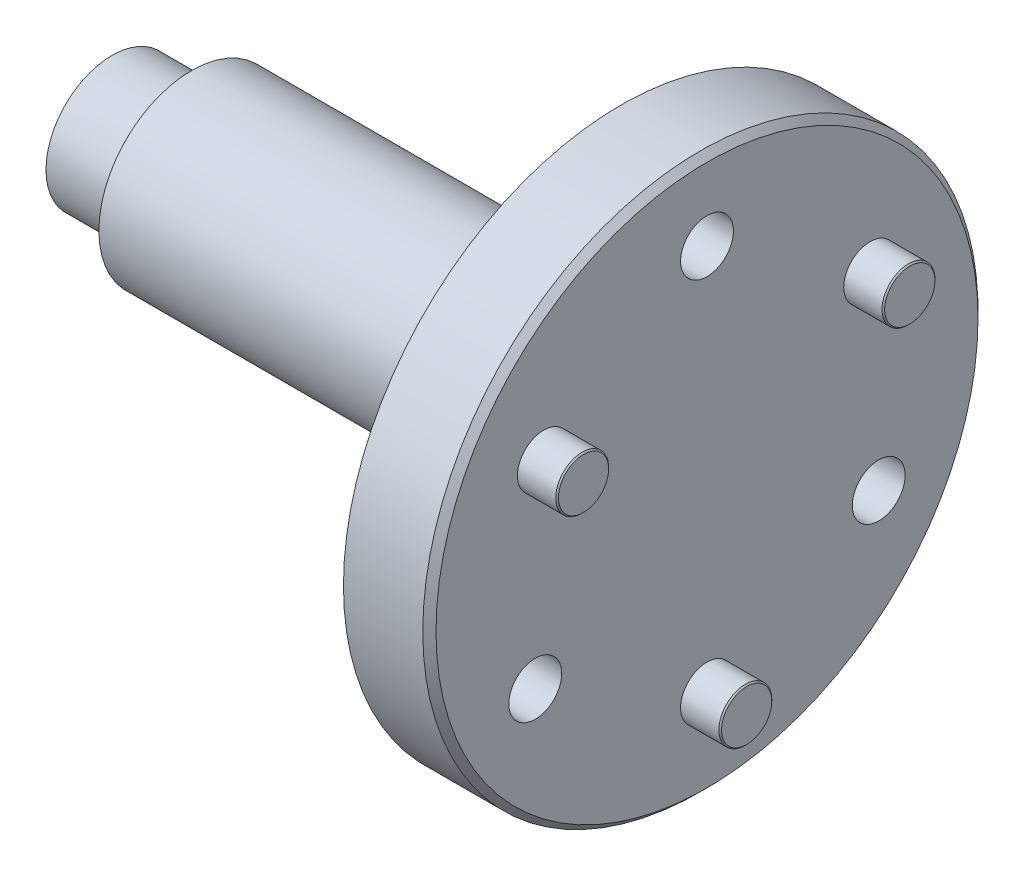
from build123d import *

# Parameters (mm, degrees)
CHAMFER1_SIZE                = 0.5
SKETCH2_R                    = 2
CUT_EXTRUDE1_DEPTH           = 6.5
CIRPATTERN1_COUNT            = 3
SKETCH3_R                    = 2
BOSS_EXTRUDE1_DEPTH          = 3
CHAMFER2_SIZE                = 0.1
CIRPATTERN3_COUNT            = 3
CHAMFER2_OF_CIRPATTERN3_SIZE = 0.1


with BuildPart() as part:
    # Sketch1 → Revolve1 (revolve)
    with BuildSketch(Plane.XY, mode=Mode.PRIVATE) as revolve1_sk:
        Polygon((-22.25, 0), (-22.25, 5), (-16.25, 5), (-16.25, 7), (16.25, 7), (16.25, 21), (22.75, 21), (22.75, 0), align=None)
    revolve(revolve1_sk.sketch.rotate(Axis((-54.078202457, 0, 0), (1, 0, 0)), 90), axis=Axis((-54.078202457, 0, 0), (1, 0, 0)))

    # Chamfer1
    chamfer1_edges = [part.edges().sort_by_distance(p)[0] for p in [
        (22.75, 0, -21),
    ]]
    chamfer(chamfer1_edges, length=CHAMFER1_SIZE)

    # Sketch2 → Cut-Extrude1 (cut)
    with BuildSketch(Plane(origin=(22.75, 0, 0), x_dir=(0, 0, -1), z_dir=(1, 0, 0))):
        with Locations((0, 15)):
            Circle(SKETCH2_R)
    cut_extrude1 = extrude(amount=-CUT_EXTRUDE1_DEPTH, mode=Mode.SUBTRACT)

    # CirPattern1: Cut-Extrude1 ×3 about axis
    cirpattern1_axis = Axis((0, 0, 0), (1, 0, 0))
    for i in range(1, CIRPATTERN1_COUNT):
        add(cut_extrude1.rotate(cirpattern1_axis, i * 360 / CIRPATTERN1_COUNT), mode=Mode.SUBTRACT)

    # Sketch3 → Boss-Extrude1 (add)
    with BuildSketch(Plane(origin=(22.75, 0, 0), x_dir=(0, 0, -1), z_dir=(1, 0, 0))):
        with Locations(Location((12.340862004, 7.125, 0), (0, 0, 180))):
            Circle(SKETCH3_R)
    boss_extrude1 = extrude(amount=BOSS_EXTRUDE1_DEPTH)

    # Chamfer2
    chamfer2_edges = [part.edges().sort_by_distance(p)[0] for p in [
        (25.75, 7.125, -14.340862004),
    ]]
    chamfer(chamfer2_edges, length=CHAMFER2_SIZE)

    # CirPattern3: Boss-Extrude1 ×3 about axis
    cirpattern3_axis = Axis((0, 0, 0), (1, 0, 0))
    for i in range(1, CIRPATTERN3_COUNT):
        add(boss_extrude1.rotate(cirpattern3_axis, i * 360 / CIRPATTERN3_COUNT))

    # Chamfer2 of CirPattern3
    chamfer2_of_cirpattern3_edges = [part.edges().sort_by_distance(p)[0] for p in [
        (25.75, 8.857050808, 13.340862004),
        (25.75, -15.982050808, 1),
    ]]
    chamfer(chamfer2_of_cirpattern3_edges, length=CHAMFER2_OF_CIRPATTERN3_SIZE)


solid = part.part
